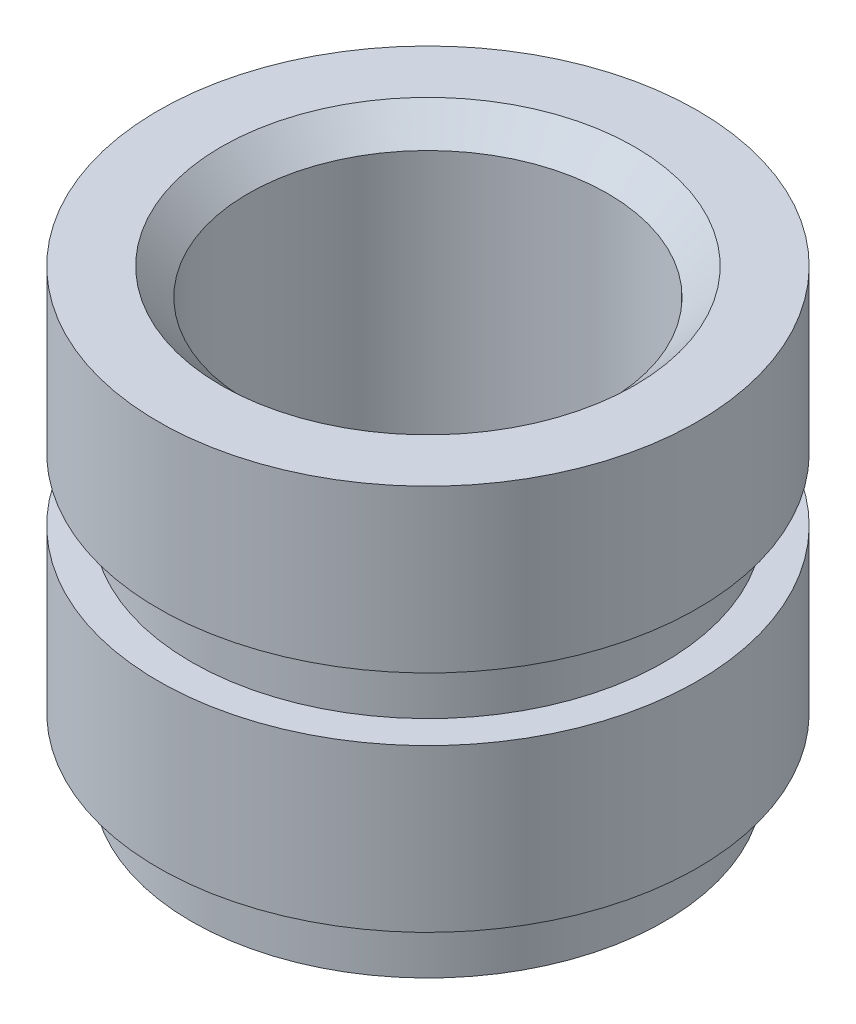
from build123d import *

# Parameters (mm, degrees)
CHAMFER_1_SIZE = 0.15


with BuildPart() as part:
    # 草图1 → 旋转1 (revolve)
    with BuildSketch(Plane.XY, mode=Mode.PRIVATE) as revolve_1_sk:
        Polygon((-1, 1.433754513), (-1.5, 1.433754513), (-1.5, 0.533754513), (-1.315884477, 0.533754513), (-1.315884477, 0.183754513), (-1.5, 0.183754513), (-1.5, -0.716245487), (-1.315884477, -0.716245487), (-1.315884477, -1.066245487), (-1, -1.066245487), align=None)
    revolve(revolve_1_sk.sketch.rotate(Axis((0, -2.604693141, 0), (0, 1, 0)), 270), axis=Axis((0, -2.604693141, 0), (0, 1, 0)))

    # 倒角1
    chamfer_1_edges = [part.edges().sort_by_distance(p)[0] for p in [
        (0, 1.433754513, 1),
        (0, -1.066245487, 1),
    ]]
    chamfer(chamfer_1_edges, length=CHAMFER_1_SIZE)


solid = part.part
